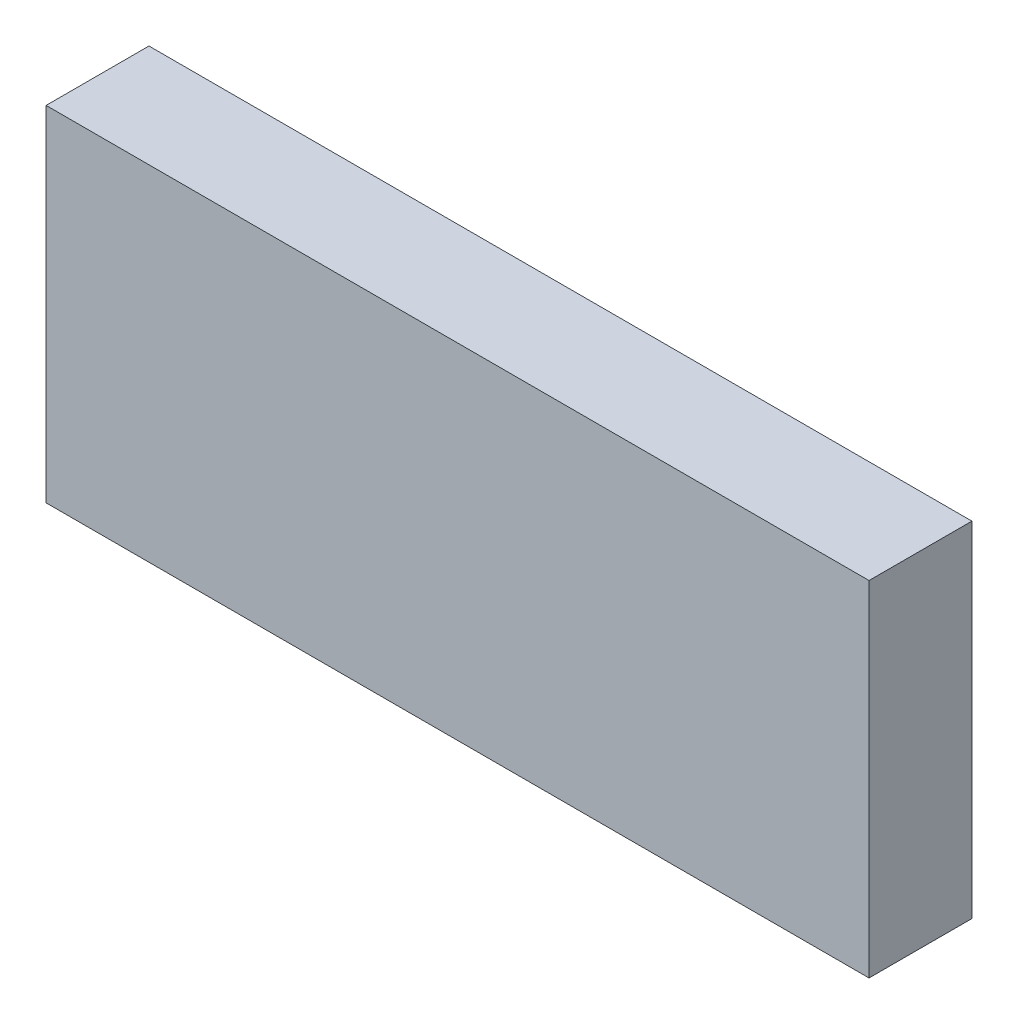
from build123d import *

# Parameters (mm, degrees)
SKETCH_1_W      = 20.32
SKETCH_1_H      = 8.5
EXTRUDE_1_DEPTH = 2.54


with BuildPart() as part:
    # 草图1 → 凸台-拉伸1 (new body)
    with BuildSketch(Plane.XY):
        with Locations((4.184242424, 1.7)):
            Rectangle(SKETCH_1_W, SKETCH_1_H)
    extrude(amount=EXTRUDE_1_DEPTH)


solid = part.part
